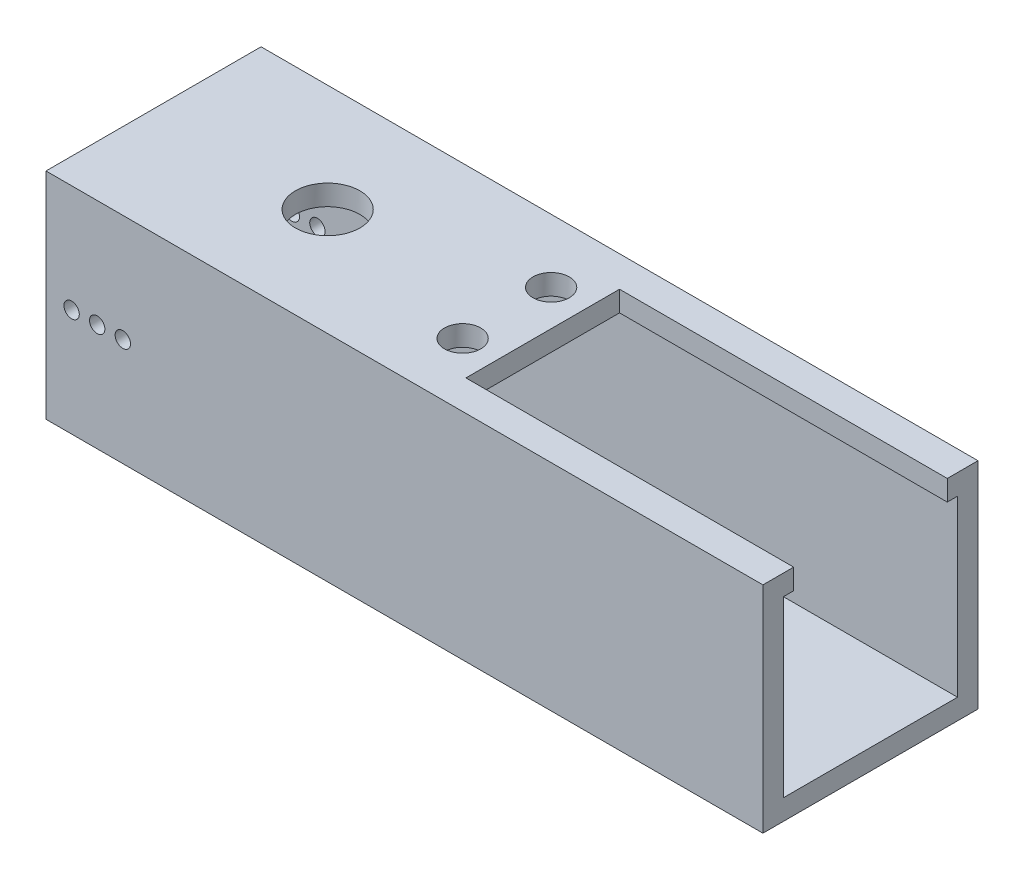
from build123d import *

# Parameters (mm, degrees)
SKETCH1_W           = 26.67
SKETCH1_H           = 26.67
SKETCH1_W_2         = 21.59
SKETCH1_H_2         = 21.59
BOSS_EXTRUDE1_DEPTH = 88.9
SKETCH2_R           = 4.0005
CUT_EXTRUDE1_DEPTH  = 94.767377723
CUT_EXTRUDE2_REACH  = 95.767
SKETCH3_R           = 2.25
SKETCH3_W           = 40.64
SKETCH3_H           = 19.05
SKETCH4_R           = 0.9525
CUT_EXTRUDE3_DEPTH  = 94.767377723


with BuildPart() as part:
    # Sketch1 → Boss-Extrude1 (new body)
    with BuildSketch(Plane(origin=(0, 0, 0), x_dir=(0, 0, -1), z_dir=(1, 0, 0))):
        Rectangle(SKETCH1_W, SKETCH1_H)
        Rectangle(SKETCH1_W_2, SKETCH1_H_2, mode=Mode.SUBTRACT)
    extrude(amount=BOSS_EXTRUDE1_DEPTH)

    # Sketch2 → Cut-Extrude1 (cut, through all)
    with BuildSketch(Plane(origin=(0, 13.335, 0), x_dir=(1, 0, 0), z_dir=(0, 1, 0))):
        with Locations(Location((21.59, 0, 0), (0, 0, 270))):
            Circle(SKETCH2_R)
    extrude(amount=-CUT_EXTRUDE1_DEPTH, mode=Mode.SUBTRACT)

    # Sketch3 → Cut-Extrude2 (cut, up to next)
    with BuildSketch(Plane(origin=(0, 13.335, 0), x_dir=(1, 0, 0), z_dir=(0, 1, 0)), mode=Mode.PRIVATE) as cut_extrude2_sk1:
        with Locations(Location((43.815, 5.487743894, 0), (0, 0, 270))):
            Circle(SKETCH3_R)
    cut_extrude2_tool1 = extrude(cut_extrude2_sk1.sketch, amount=-CUT_EXTRUDE2_REACH, mode=Mode.PRIVATE) & part.part
    # Sketch3 → Cut-Extrude2 (cut, up to next)
    with BuildSketch(Plane(origin=(0, 13.335, 0), x_dir=(1, 0, 0), z_dir=(0, 1, 0)), mode=Mode.PRIVATE) as cut_extrude2_sk2:
        with Locations(Location((43.815, -5.487743894, 0), (0, 0, 270))):
            Circle(SKETCH3_R)
    cut_extrude2_tool2 = extrude(cut_extrude2_sk2.sketch, amount=-CUT_EXTRUDE2_REACH, mode=Mode.PRIVATE) & part.part
    # Sketch3 → Cut-Extrude2 (cut, up to next)
    with BuildSketch(Plane(origin=(0, 13.335, 0), x_dir=(1, 0, 0), z_dir=(0, 1, 0)), mode=Mode.PRIVATE) as cut_extrude2_sk3:
        with Locations((68.58, 0)):
            Rectangle(SKETCH3_W, SKETCH3_H)
    cut_extrude2_tool3 = extrude(cut_extrude2_sk3.sketch, amount=-CUT_EXTRUDE2_REACH, mode=Mode.PRIVATE) & part.part
    add(cut_extrude2_tool1.solids().sort_by_distance((43.815, 13.335, -5.487744))[0], mode=Mode.SUBTRACT)
    add(cut_extrude2_tool2.solids().sort_by_distance((43.815, 13.335, 5.487744))[0], mode=Mode.SUBTRACT)
    add(cut_extrude2_tool3.solids().sort_by_distance((68.58, 13.335, 0))[0], mode=Mode.SUBTRACT)

    # Sketch4 → Cut-Extrude3 (cut, through all)
    with BuildSketch(Plane.XY.offset(13.335)):
        with Locations((6.35, 0)):
            Circle(SKETCH4_R)
        with Locations((3.175, 0)):
            Circle(SKETCH4_R)
        with Locations((9.525, 0)):
            Circle(SKETCH4_R)
    extrude(amount=-CUT_EXTRUDE3_DEPTH, mode=Mode.SUBTRACT)


solid = part.part
